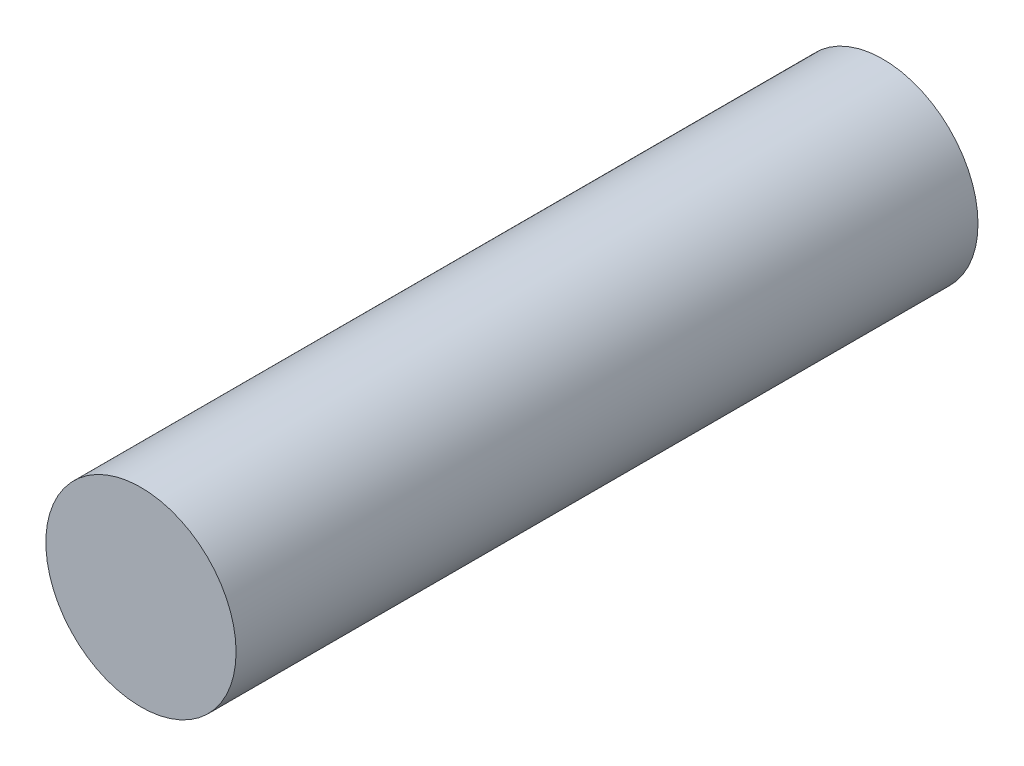
from build123d import *

# Parameters (mm, degrees)
SECTION_AIGUILLE_R = 1
AIGUILLE_DEPTH     = 7.8


with BuildPart() as part:
    # section-aiguille → aiguille (new body)
    with BuildSketch(Plane.XY.offset(7.194932501)):
        with Locations((11.122661116, -5.73115457)):
            Circle(SECTION_AIGUILLE_R)
    extrude(amount=-AIGUILLE_DEPTH)


solid = part.part
